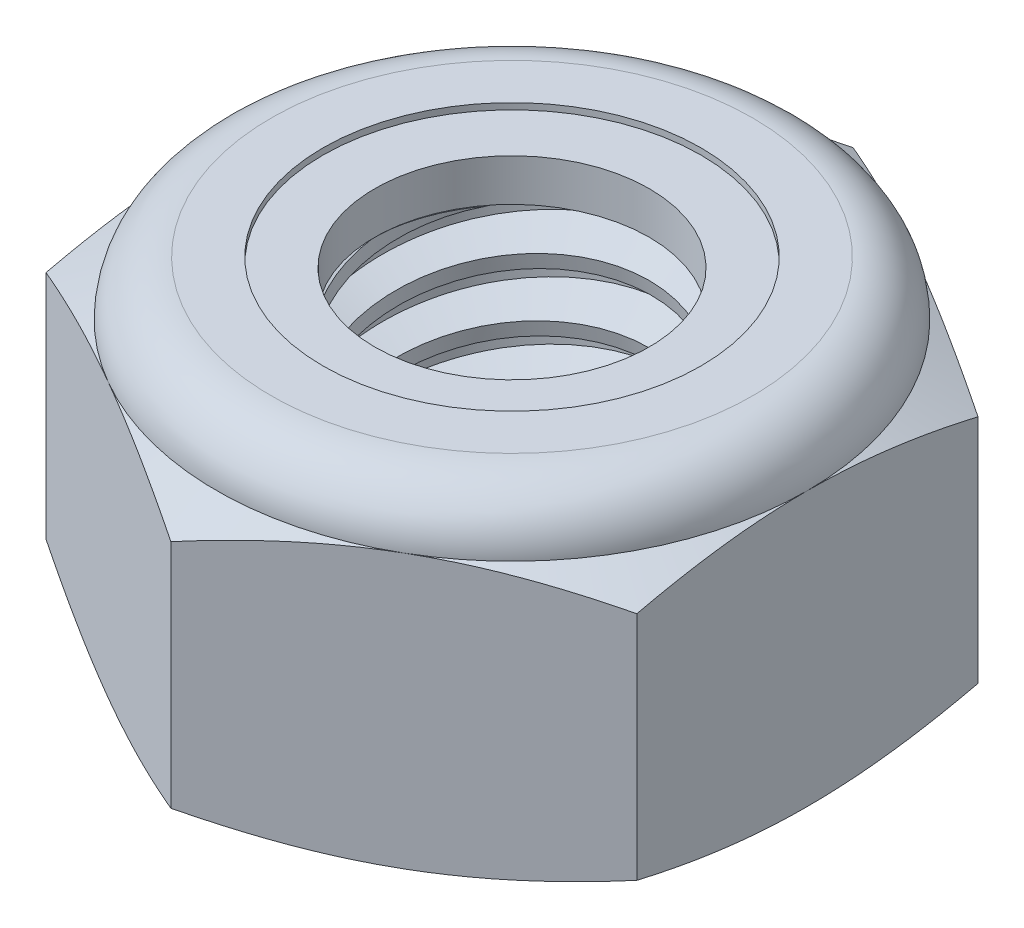
from build123d import *

# Parameters (mm, degrees)
EXTRUDE1_DEPTH      = 7.9375
SKETCH2_W           = 3.9624
SKETCH2_H           = 7.9375
LPATTERN1_COUNT     = 6
LPATTERN1_PITCH     = 1.411111111
LPATTERN1_COL_COUNT = 2
LPATTERN1_COL_PITCH = 1.411111111


with BuildPart() as part:
    # Sketch1 → Extrude1 (new body)
    with BuildSketch(Plane(origin=(0, 0, 0), x_dir=(1, 0, 0), z_dir=(0, 1, 0))):
        Polygon((0, 8.248891971), (-7.14375, 4.124445986), (-7.14375, -4.124445986), (0, -8.248891971), (7.14375, -4.124445986), (7.14375, 4.124445986), align=None)
    extrude(amount=EXTRUDE1_DEPTH)

    # Sketch4 → Cut-Revolve2 (revolve, cut)
    with BuildSketch(Plane(origin=(0, 0, 0), x_dir=(0, 0, -1), z_dir=(1, 0, 0))):
        Polygon((0, 7.9375), (3.9624, 7.9375), (3.318668226, 7.637322944), (3.318668226, 0.300177056), (3.9624, 0), (0, 0), align=None)
    revolve(axis=Axis((0, 7.9375, 0), (0, 1, 0)), mode=Mode.SUBTRACT)


with BuildPart() as body_2:
    # Sketch2 → Revolve1 (revolve)
    with BuildSketch(Plane(origin=(0, 0, 0), x_dir=(0, 0, -1), z_dir=(1, 0, 0))):
        with Locations((1.9812, 3.96875)):
            Rectangle(SKETCH2_W, SKETCH2_H)
    revolve(axis=Axis((0, -3.9624, 0), (0, 1, 0)))

    # Sketch3 → Cut-Revolve1 (revolve, cut)
    with BuildSketch(Plane(origin=(0, 0, 0), x_dir=(0, 0, -1), z_dir=(1, 0, 0)), mode=Mode.PRIVATE) as cut_revolve1_sk:
        Polygon((3.993321894, 7.763842646), (4.209775148, 6.548241167), (3.380512014, 6.848488826), (3.318668226, 7.195803534), align=None)
    cut_revolve1 = revolve(cut_revolve1_sk.sketch.rotate(Axis((0, 7.9375, 0.26919352), (0, -0.9845141333311523, -0.1753052231715019)), 180), axis=Axis((0, 7.9375, 0.26919352), (0, -0.9845141333311523, -0.1753052231715019)), mode=Mode.SUBTRACT)

    # LPattern1: Cut-Revolve1 ×6
    with Locations(*[(0, -i * LPATTERN1_PITCH, 0) for i in range(1, LPATTERN1_COUNT)]):
        add(cut_revolve1, mode=Mode.SUBTRACT)

    # LPattern1 col: Cut-Revolve1 ×2
    with Locations(*[(0, i * LPATTERN1_COL_PITCH, 0) for i in range(1, LPATTERN1_COL_COUNT)]):
        add(cut_revolve1, mode=Mode.SUBTRACT)


with BuildPart() as part_1:
    add(part.part)

    # Combine1: cut body 2
    add(body_2.part, mode=Mode.SUBTRACT)

    # Sketch5 → Cut-Revolve3 (revolve, cut)
    with BuildSketch(Plane(origin=(0, 0, 0), x_dir=(0, 0, -1), z_dir=(1, 0, 0)), mode=Mode.PRIVATE) as cut_revolve3_sk:
        with BuildLine():
            Line((0, 0), (7.14375, 0))
            Line((7.14375, 0), (8.248891971, 0.515336164))
            Line((8.248891971, 0.515336164), (8.248891971, 6.099247169))
            Line((8.248891971, 6.099247169), (7.14375, 6.614583333))
            ThreePointArc((7.14375, 6.614583333), (6.756276679, 7.550026679), (5.820833333, 7.9375))
            Line((5.820833333, 7.9375), (5.820833333, 9.2075))
            Line((5.820833333, 9.2075), (9.518891971, 9.2075))
            Line((9.518891971, 9.2075), (9.518891971, -1.27))
            Line((9.518891971, -1.27), (0, -1.27))
            Line((0, -1.27), (0, 0))
        make_face()
    revolve(cut_revolve3_sk.sketch.rotate(Axis((0, 0, 0), (0, 1, 0)), 54.613905467), axis=Axis((0, 0, 0), (0, 1, 0)), mode=Mode.SUBTRACT)

    # Sketch6 → Cut-Revolve4 (revolve, cut)
    with BuildSketch(Plane(origin=(0, 0, 0), x_dir=(0, 0, -1), z_dir=(1, 0, 0)), mode=Mode.PRIVATE) as cut_revolve4_sk:
        with BuildLine():
            Line((0, 6.614583333), (6.99135, 6.614583333))
            ThreePointArc((6.99135, 6.614583333), (6.648513606, 7.442263606), (5.820833333, 7.7851))
            Line((5.820833333, 7.7851), (4.56975078, 7.7851))
            Line((4.56975078, 7.7851), (4.56975078, 9.2075))
            Line((4.56975078, 9.2075), (0, 9.2075))
            Line((0, 9.2075), (0, 6.614583333))
        make_face()
    revolve(cut_revolve4_sk.sketch.rotate(Axis((0, 9.2075, 0), (0, 1, 0)), 14.946563008), axis=Axis((0, 9.2075, 0), (0, 1, 0)), mode=Mode.SUBTRACT)


with BuildPart() as body_2_2:
    # Sketch7 → Revolve2 (revolve)
    with BuildSketch(Plane(origin=(0, 0, 0), x_dir=(0, 0, -1), z_dir=(1, 0, 0))):
        with BuildLine():
            Line((3.318668226, 6.690783333), (6.912493778, 6.690783333))
            ThreePointArc((6.912493778, 6.690783333), (6.567205237, 7.4148695), (5.820833333, 7.7089))
            Line((5.820833333, 7.7089), (3.318668226, 7.7089))
            Line((3.318668226, 7.7089), (3.318668226, 6.690783333))
        make_face()
    revolve(axis=Axis((0, 6.690783333, 0), (0, 1, 0)))


solid = Compound([part_1.part, body_2_2.part])
